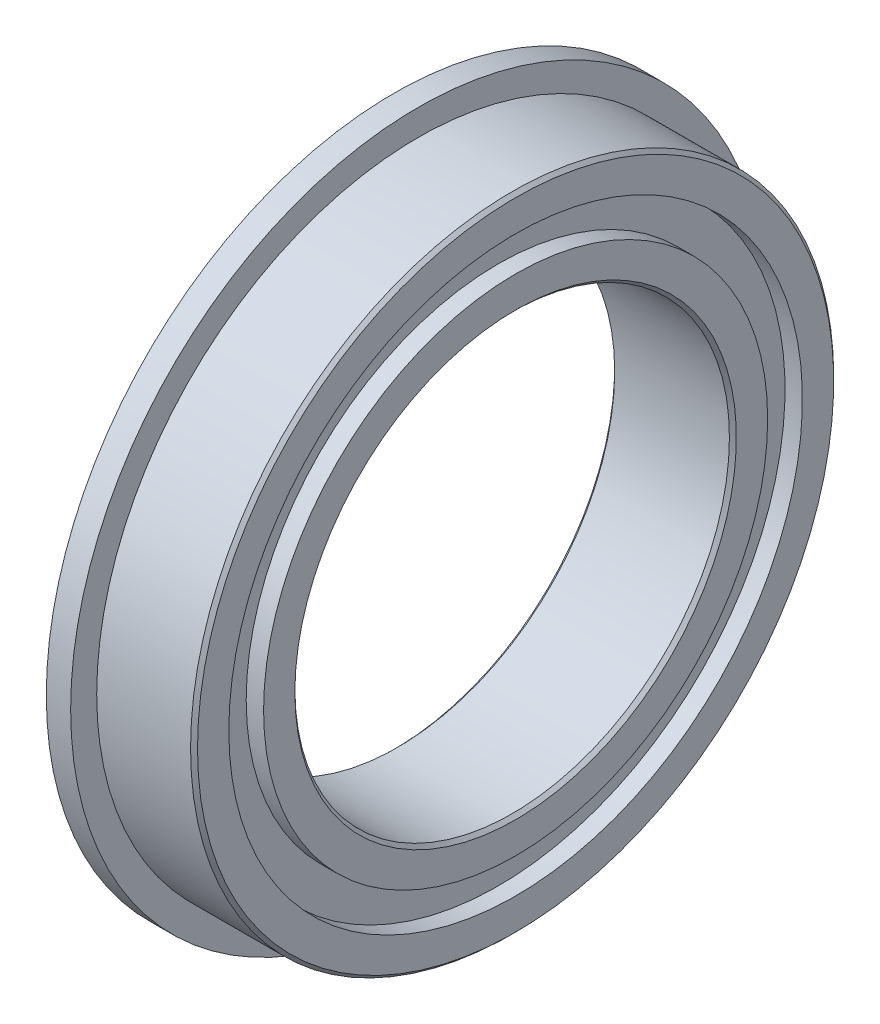
from build123d import *


with BuildPart() as part:
    # Sketch2 → Revolve1 (revolve)
    with BuildSketch(Plane(origin=(0, 0, 0), x_dir=(1, 0, 0), z_dir=(0, 1, 0)), mode=Mode.PRIVATE) as revolve1_sk:
        Polygon((0, 12.7), (0, 14.5), (1, 14.5), (1, 16.5), (0, 16.5), (0, 20), (1.4, 20), (1.4, 18.5), (6.8, 18.5), (7, 18.3), (7, 16.5), (6, 16.5), (6, 14.5), (7, 14.5), (7, 12.7), (6.8, 12.5), (0.2, 12.5), align=None)
    revolve(revolve1_sk.sketch.rotate(Axis((0, 0, 0), (1, 0, 0)), 180), axis=Axis((0, 0, 0), (1, 0, 0)))


solid = part.part
